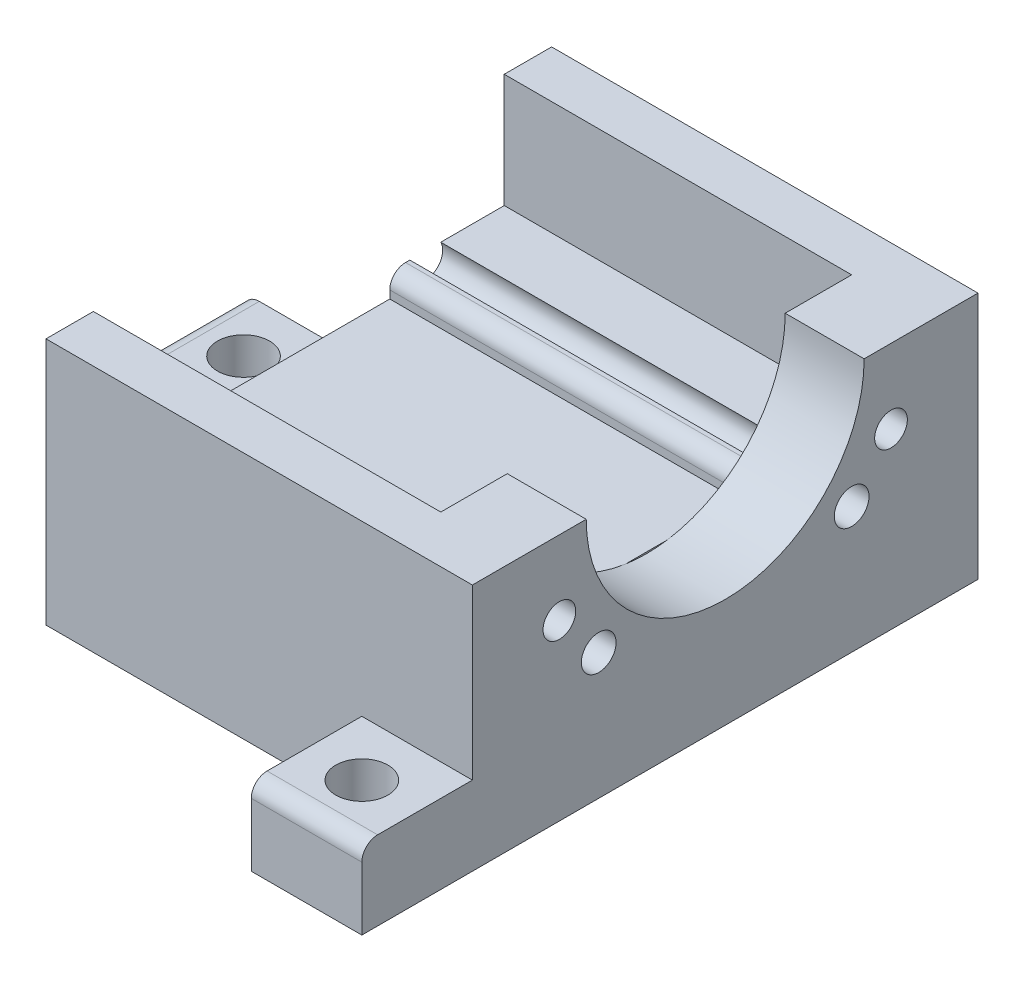
from build123d import *

# Parameters (mm, degrees)
BOSS_EXTRUDE1_DEPTH = 11
SKETCH3_W           = 22
SKETCH3_H           = 3
BOSS_EXTRUDE2_DEPTH = 15.7
BOSS_EXTRUDE3_DEPTH = 5
SKETCH5_R           = 1.035
SKETCH5_R_2         = 1.1
CUT_EXTRUDE1_DEPTH  = 36.096650541
SKETCH6_W           = 7
SKETCH6_H           = 7
BOSS_EXTRUDE4_DEPTH = 5
SKETCH7_R           = 1.65
CUT_EXTRUDE2_DEPTH  = 32.1110829
FILLET1_R           = 1


with BuildPart() as part:
    # Sketch1 → Boss-Extrude1 (new, symmetric)
    with BuildSketch(Plane(origin=(0, 0, 0), x_dir=(0, 0, -1), z_dir=(1, 0, 0))):
        Polygon((-13.0089, 0), (13.0089, 0), (13.0089, 8.5), (5.7589, 8.5), (5.7589, 7), (-5.7589, 7), (-5.7589, 8.5), (-13.0089, 8.5), align=None)
    extrude(amount=BOSS_EXTRUDE1_DEPTH, both=True)

    # Sketch3 → Boss-Extrude2 (add)
    with BuildSketch(Plane.XZ):
        with Locations((0, -14.5089)):
            Rectangle(SKETCH3_W, SKETCH3_H)
        with Locations((0, 14.5089)):
            Rectangle(SKETCH3_W, SKETCH3_H)
    extrude(amount=-BOSS_EXTRUDE2_DEPTH)

    # Sketch4 → Boss-Extrude3 (add)
    with BuildSketch(Plane(origin=(11, 0, 0), x_dir=(0, 0, -1), z_dir=(1, 0, 0))):
        with BuildLine():
            Line((-8.8, 15.7), (-16.0089, 15.7))
            Line((-16.0089, 15.7), (-16.0089, 0))
            Line((-16.0089, 0), (16.0089, 0))
            Line((16.0089, 0), (16.0089, 15.7))
            Line((16.0089, 15.7), (8.8, 15.7))
            ThreePointArc((8.8, 15.7), (0, 6.9), (-8.8, 15.7))
        make_face()
    extrude(amount=BOSS_EXTRUDE3_DEPTH)

    # Sketch5 → Cut-Extrude1 (cut, through all)
    with BuildSketch(Plane(origin=(16, 0, 0), x_dir=(0, 0, -1), z_dir=(1, 0, 0))):
        with Locations((-10.5, 11)):
            Circle(SKETCH5_R)
        with Locations((10.5, 11)):
            Circle(SKETCH5_R)
        with Locations((-8.0089, 8)):
            Circle(SKETCH5_R_2)
        with Locations(Location((8.0089, 8, 0), (0, 0, 27.035691789))):
            Circle(SKETCH5_R_2)
    extrude(amount=-CUT_EXTRUDE1_DEPTH, mode=Mode.SUBTRACT)

    # Sketch6 → Boss-Extrude4 (add)
    with BuildSketch(Plane.XZ):
        with Locations((12.5, 19.5089)):
            Rectangle(SKETCH6_W, SKETCH6_H)
        with Locations((-14.5, 0)):
            Rectangle(SKETCH6_W, SKETCH6_H)
    extrude(amount=-BOSS_EXTRUDE4_DEPTH)

    # Sketch7 → Cut-Extrude2 (cut, through all)
    with BuildSketch(Plane(origin=(0, 5, 0), x_dir=(1, 0, 0), z_dir=(0, 1, 0))):
        with Locations(Location((-14.5, 0, 0), (0, 0, 270))):
            Circle(SKETCH7_R)
        with Locations(Location((12.5, -19.5089, 0), (0, 0, 270))):
            Circle(SKETCH7_R)
    extrude(amount=-CUT_EXTRUDE2_DEPTH, mode=Mode.SUBTRACT)

    # Fillet1
    fillet1_edges = [part.edges().sort_by_distance(p)[0] for p in [
        (-18, 5, 0),
        (12.5, 5, 23.0089),
        (0, 8.5, 5.7589),
        (0, 8.5, -5.7589),
    ]]
    fillet(fillet1_edges, radius=FILLET1_R)


solid = part.part
